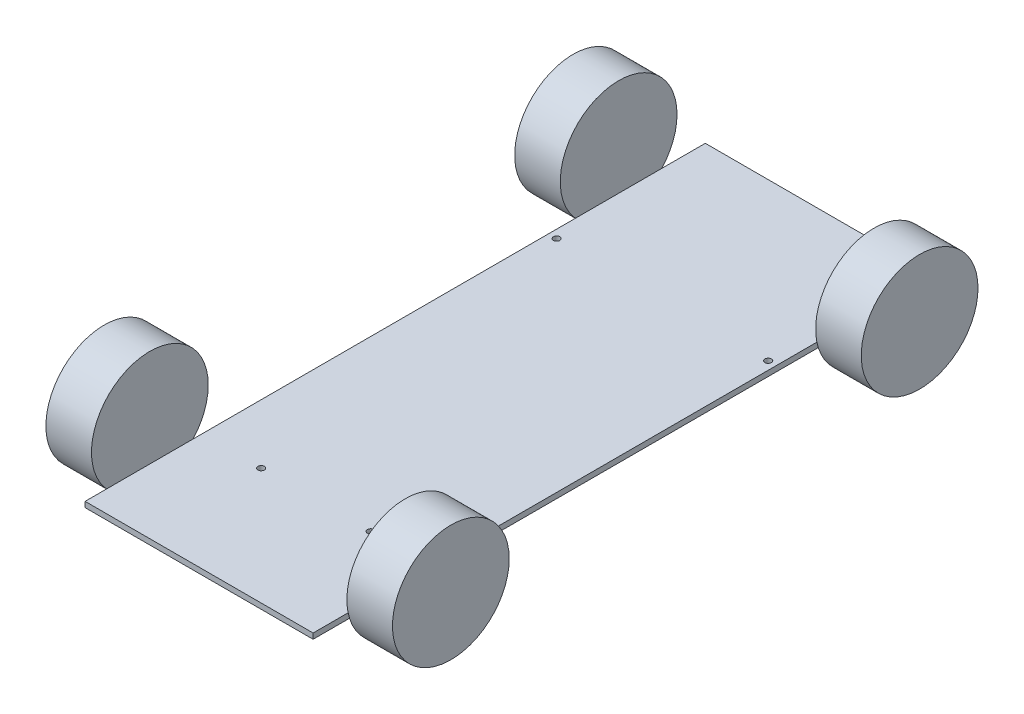
from build123d import *

# Parameters (mm, degrees)
SKETCH1_W             = 125
SKETCH1_H             = 340
SKETCH1_R             = 1.778
BOSS_EXTRUDE1_DEPTH   = 3
BOSS_EXTRUDE2_START   = 70
SKETCH2_R             = 32
BOSS_EXTRUDE2_DEPTH   = 25
BOSS_EXTRUDE2_2_DEPTH = 25


with BuildPart() as part:
    # Sketch1 → Boss-Extrude1 (new body)
    with BuildSketch(Plane(origin=(0, 0, 0), x_dir=(1, 0, 0), z_dir=(0, 1, 0))):
        Rectangle(SKETCH1_W, SKETCH1_H)
        with Locations(Location((-58, 84, 0), (0, 0, 270))):
            Circle(SKETCH1_R, mode=Mode.SUBTRACT)
        with Locations(Location((58, 84, 0), (0, 0, 270))):
            Circle(SKETCH1_R, mode=Mode.SUBTRACT)
        with Locations(Location((-30, -106, 0), (0, 0, 270))):
            Circle(SKETCH1_R, mode=Mode.SUBTRACT)
        with Locations(Location((30, -106, 0), (0, 0, 270))):
            Circle(SKETCH1_R, mode=Mode.SUBTRACT)
    extrude(amount=BOSS_EXTRUDE1_DEPTH)


with BuildPart() as body_2:
    # Sketch2 → Boss-Extrude2 (new body)
    with BuildSketch(Plane(origin=(0, 0, 0), x_dir=(0, 0, -1), z_dir=(1, 0, 0)).offset(BOSS_EXTRUDE2_START)):
        with Locations((130, 17)):
            Circle(SKETCH2_R)
    extrude(amount=BOSS_EXTRUDE2_DEPTH)


with BuildPart() as body_3:
    # Sketch2 → Boss-Extrude2 2 (new body)
    with BuildSketch(Plane(origin=(0, 0, 0), x_dir=(0, 0, -1), z_dir=(1, 0, 0)).offset(BOSS_EXTRUDE2_START)):
        with Locations((-127, 17)):
            Circle(SKETCH2_R)
    extrude(amount=BOSS_EXTRUDE2_2_DEPTH)


with BuildPart() as body_4:
    # Mirror5: mirrored copy
    add(body_2.part.mirror(Plane(origin=(0, 0, 0), x_dir=(0, 0, 1), z_dir=(1, 0, 0))))


with BuildPart() as body_5:
    # Mirror5 2: mirrored copy
    add(body_3.part.mirror(Plane(origin=(0, 0, 0), x_dir=(0, 0, 1), z_dir=(1, 0, 0))))


solid = Compound([part.part, body_2.part, body_3.part, body_4.part, body_5.part])
